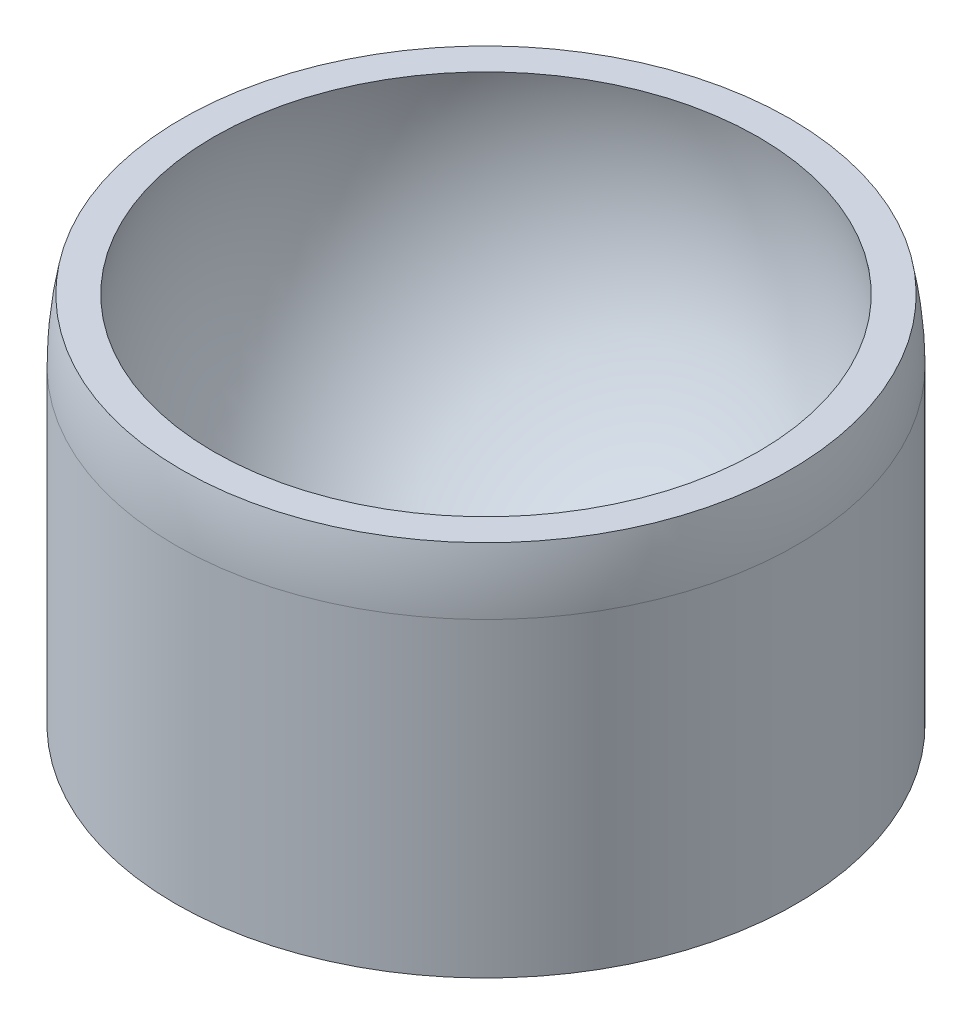
from build123d import *

# Parameters (mm, degrees)
CUT_EXTRUDE1_DEPTH      = 20
CUT_EXTRUDE1_DEPTH_BACK = 20
SKETCH3_W               = 20
SKETCH3_H               = 10
SHELL1_T                = -1
BOSS_EXTRUDE1_REACH     = 20.547
SKETCH5_R               = 10


with BuildPart() as part:
    # Sketch2 → Revolve1 (revolve)
    with BuildSketch(Plane.XY):
        with BuildLine():
            Line((0, -10), (0, 10))
            ThreePointArc((0, 10), (10, 0), (0, -10))
        make_face()
    revolve(axis=Axis((0, -10, 0), (0, 1, 0)))

    # Sketch3 → Cut-Extrude1 (cut, two sides: drawn at the far end of the back side and taken through both)
    with BuildSketch(Plane(origin=(0, 0, 0), x_dir=(0, 0, -1), z_dir=(1, 0, 0)).offset(-CUT_EXTRUDE1_DEPTH_BACK)):
        with Locations((0, 7)):
            Rectangle(SKETCH3_W, SKETCH3_H)
    extrude(amount=CUT_EXTRUDE1_DEPTH + CUT_EXTRUDE1_DEPTH_BACK, mode=Mode.SUBTRACT)

    # Shell1
    shell1_openings = [part.faces().sort_by_distance(p)[0] for p in [
        (0, 2, 0),
    ]]
    offset(amount=SHELL1_T, openings=shell1_openings, kind=Kind.INTERSECTION)

    # Sketch5 → Boss-Extrude1 (add, up to next)
    with BuildSketch(Plane(origin=(0, -10, 0), x_dir=(1, 0, 0), z_dir=(0, 1, 0)), mode=Mode.PRIVATE) as boss_extrude1_sk1:
        Circle(SKETCH5_R)
    boss_extrude1_tool1 = extrude(boss_extrude1_sk1.sketch, amount=BOSS_EXTRUDE1_REACH, mode=Mode.PRIVATE) - part.part
    add(boss_extrude1_tool1.solids().sort_by_distance((0, -10, 0))[0])


solid = part.part
